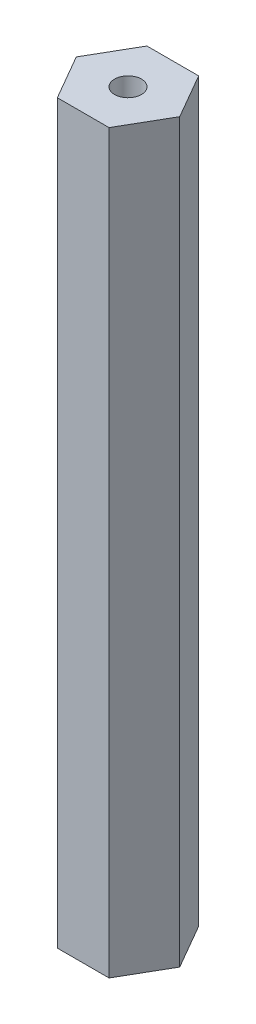
from build123d import *

# Parameters (mm, degrees)
EXTRUDE_1_DEPTH     = 41.1
SKETCH_2_R          = 0.75
CUT_EXTRUDE_1_DEPTH = 42.277031547


with BuildPart() as part:
    # Эскиз1 → Бобышка-Вытянуть1 (new body)
    with BuildSketch(Plane(origin=(0, 0, 0), x_dir=(1, 0, 0), z_dir=(0, 1, 0))):
        Polygon((2.886751346, 0), (1.443375673, 2.5), (-1.443375673, 2.5), (-2.886751346, 0), (-1.443375673, -2.5), (1.443375673, -2.5), align=None)
    extrude(amount=EXTRUDE_1_DEPTH)

    # Эскиз2 → Вырез-Вытянуть1 (cut, through all)
    with BuildSketch(Plane(origin=(0, 41.1, 0), x_dir=(1, 0, 0), z_dir=(0, 1, 0))):
        with Locations(Location((0, 0, 0), (0, 0, 270))):
            Circle(SKETCH_2_R)
    extrude(amount=-CUT_EXTRUDE_1_DEPTH, mode=Mode.SUBTRACT)


solid = part.part
